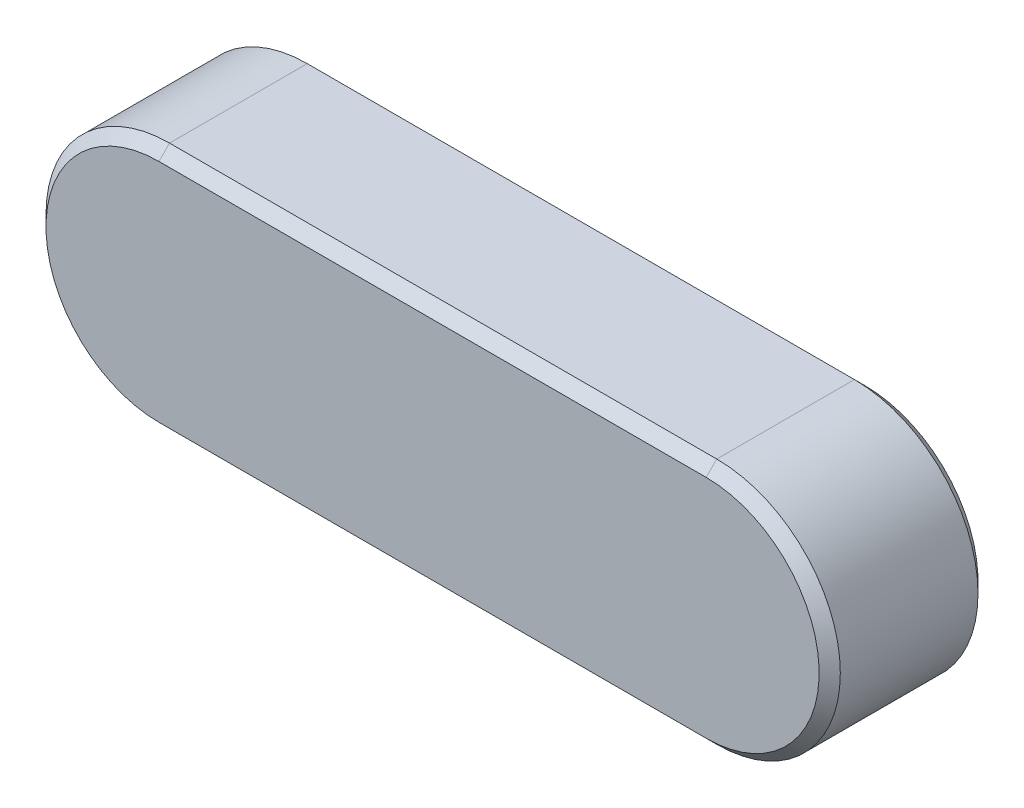
from build123d import *

# Parameters (mm, degrees)
BASEKEY_DEPTH = 4.5
CHAMFER1_SIZE = 0.6


with BuildPart() as part:
    # Sketch1 → BaseKey (new, symmetric)
    with BuildSketch(Plane.XY):
        with BuildLine():
            Line((-31, 7), (0, 7))
            ThreePointArc((0, 7), (7, 0), (0, -7))
            Line((0, -7), (-31, -7))
            ThreePointArc((-31, -7), (-38, 0), (-31, 7))
        make_face()
    extrude(amount=BASEKEY_DEPTH, both=True)

    # Chamfer1
    chamfer1_edges = [part.edges().sort_by_distance(p)[0] for p in [
        (7, 0, 4.5),
        (-15.5, 7, 4.5),
        (-38, 0, 4.5),
        (-15.5, 7, -4.5),
        (7, 0, -4.5),
        (-15.5, -7, -4.5),
        (-38, 0, -4.5),
        (-15.5, -7, 4.5),
    ]]
    chamfer(chamfer1_edges, length=CHAMFER1_SIZE)


solid = part.part
